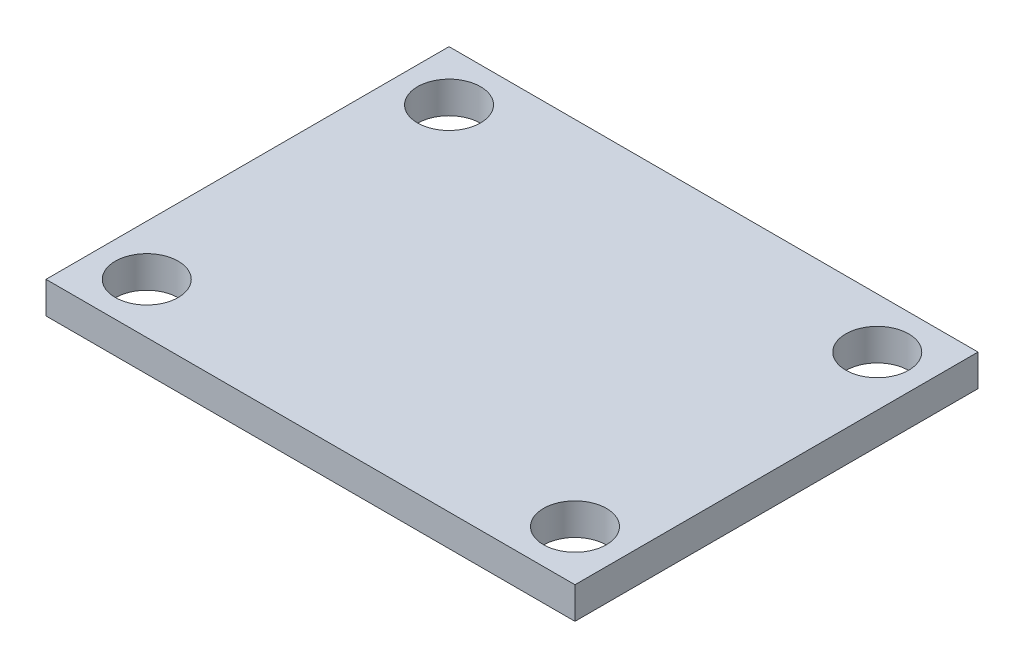
from build123d import *

# Parameters (mm, degrees)
SKETCH1_W           = 26.67
SKETCH1_H           = 20.32
SKETCH1_R           = 1.5875
BOSS_EXTRUDE1_DEPTH = 1.6002


with BuildPart() as part:
    # Sketch1 → Boss-Extrude1 (new body)
    with BuildSketch(Plane(origin=(0, 0, 0), x_dir=(1, 0, 0), z_dir=(0, 1, 0))):
        Rectangle(SKETCH1_W, SKETCH1_H)
        with Locations(Location((-10.795, 7.62, 0), (0, 0, 270))):
            Circle(SKETCH1_R, mode=Mode.SUBTRACT)
        with Locations(Location((10.795, 7.62, 0), (0, 0, 270))):
            Circle(SKETCH1_R, mode=Mode.SUBTRACT)
        with Locations(Location((10.795, -7.62, 0), (0, 0, 270))):
            Circle(SKETCH1_R, mode=Mode.SUBTRACT)
        with Locations(Location((-10.795, -7.62, 0), (0, 0, 270))):
            Circle(SKETCH1_R, mode=Mode.SUBTRACT)
    extrude(amount=BOSS_EXTRUDE1_DEPTH)


solid = part.part
